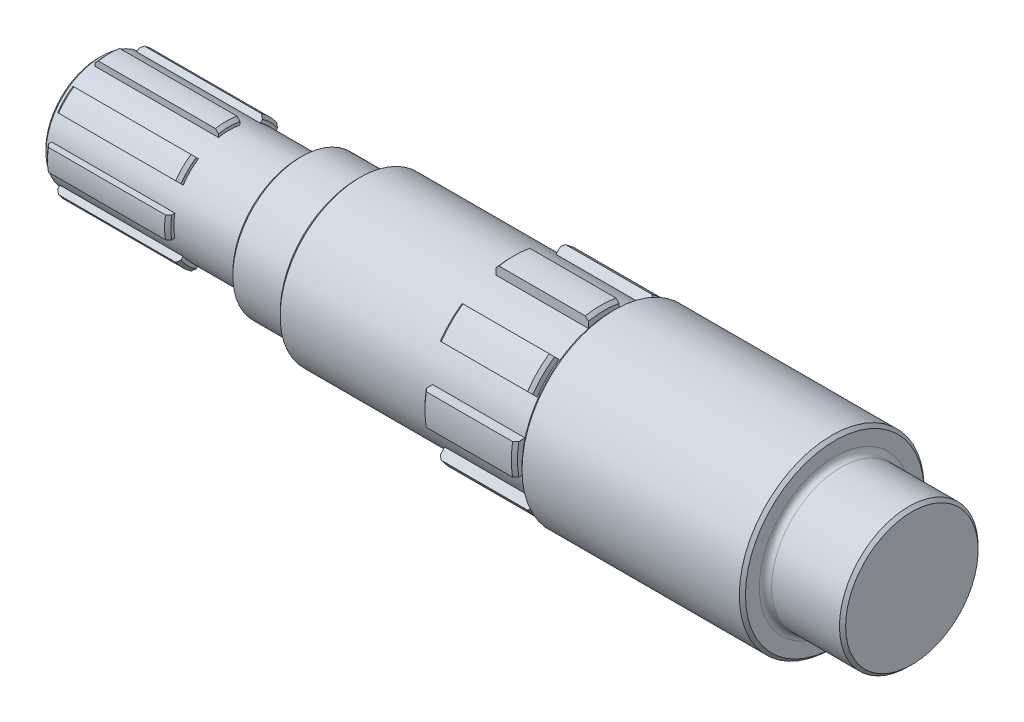
from build123d import *
from build123d.topology import SkipClean

# Parameters (mm, degrees)
CHAMFER1_SIZE      = 1
CUT_EXTRUDE1_REACH = 266.919
CUT_EXTRUDE2_REACH = 142.556
FILLET1_R          = 2


with BuildPart() as part:
    # Sketch1 → Revolve1 (revolve)
    with BuildSketch(Plane.XY, mode=Mode.PRIVATE) as revolve1_sk:
        Polygon((-90.956521739, 18), (-90.956521739, 22.347826087), (-71.956521739, 22.347826087), (-71.956521739, 26), (-21.956521739, 26), (-21.956521739, 29), (8.043478261, 29), (8.043478261, 26), (10.543478261, 26), (10.543478261, 30), (83.043478261, 30), (83.043478261, 22.5), (108.043478261, 22.5), (108.043478261, 0), (-155.956521739, 0), (-155.956521739, 18), (-153.456521739, 18), (-153.456521739, 20), (-113.456521739, 20), (-113.456521739, 18), align=None)
    revolve(revolve1_sk.sketch.rotate(Axis((-155.956521739, 0, 0), (1, 0, 0)), 90), axis=Axis((-155.956521739, 0, 0), (1, 0, 0)))

    # Chamfer1
    chamfer1_edges = [part.edges().sort_by_distance(p)[0] for p in [
        (108.043478261, 0, -22.5),
        (83.043478261, 0, -30),
        (10.543478261, 0, -30),
        (8.043478261, 0, -29),
        (-21.956521739, 0, -29),
        (-71.956521739, 0, -26),
        (-90.956521739, 0, -22.347826087),
        (-113.456521739, 0, -20),
        (-153.456521739, 0, -20),
        (-155.956521739, 0, -18),
    ]]
    chamfer(chamfer1_edges, length=CHAMFER1_SIZE)

    # Cut-Extrude1: up to this face of the body (flat: up to its plane)
    cut_extrude1_end = Plane(part.part.faces().sort_by_distance((-113.456521739, 0, -18.462598846))[0])
    # Sketch2 → Cut-Extrude1 (cut, up to the picked face)
    with BuildSketch(Plane.ZY.offset(153.456521739), mode=Mode.PRIVATE) as cut_extrude1_sk1:
        with BuildLine():
            Line((-3.5, 19.691368668), (-3.5, 17.656443583))
            ThreePointArc((-3.5, 17.656443583), (-6.888301783, 16.629831585), (-10.010117255, 14.959864723))
            Line((-10.010117255, 14.959864723), (-11.449026581, 16.39877405))
            ThreePointArc((-11.449026581, 16.39877405), (-7.653668647, 18.47759065), (-3.5, 19.691368668))
        make_face()
    cut_extrude1_tool1 = split(extrude(cut_extrude1_sk1.sketch, amount=-CUT_EXTRUDE1_REACH, mode=Mode.PRIVATE), bisect_by=cut_extrude1_end, keep=Keep.BOTH, mode=Mode.PRIVATE)
    # Sketch2 → Cut-Extrude1 (cut, up to the picked face)
    with BuildSketch(Plane.ZY.offset(153.456521739), mode=Mode.PRIVATE) as cut_extrude1_sk2:
        with BuildLine():
            Line((3.5, 19.691368668), (3.5, 17.656443583))
            ThreePointArc((3.5, 17.656443583), (6.888301783, 16.629831585), (10.010117255, 14.959864723))
            Line((10.010117255, 14.959864723), (11.449026581, 16.39877405))
            ThreePointArc((11.449026581, 16.39877405), (7.653668647, 18.47759065), (3.5, 19.691368668))
        make_face()
    cut_extrude1_tool2 = split(extrude(cut_extrude1_sk2.sketch, amount=-CUT_EXTRUDE1_REACH, mode=Mode.PRIVATE), bisect_by=cut_extrude1_end, keep=Keep.BOTH, mode=Mode.PRIVATE)
    # Sketch2 → Cut-Extrude1 (cut, up to the picked face)
    with BuildSketch(Plane.ZY.offset(153.456521739), mode=Mode.PRIVATE) as cut_extrude1_sk3:
        with BuildLine():
            Line((16.39877405, 11.449026581), (14.959864723, 10.010117255))
            ThreePointArc((14.959864723, 10.010117255), (16.629831585, 6.888301783), (17.656443583, 3.5))
            Line((17.656443583, 3.5), (19.691368668, 3.5))
            ThreePointArc((19.691368668, 3.5), (18.47759065, 7.653668647), (16.39877405, 11.449026581))
        make_face()
    cut_extrude1_tool3 = split(extrude(cut_extrude1_sk3.sketch, amount=-CUT_EXTRUDE1_REACH, mode=Mode.PRIVATE), bisect_by=cut_extrude1_end, keep=Keep.BOTH, mode=Mode.PRIVATE)
    # Sketch2 → Cut-Extrude1 (cut, up to the picked face)
    with BuildSketch(Plane.ZY.offset(153.456521739), mode=Mode.PRIVATE) as cut_extrude1_sk4:
        with BuildLine():
            Line((19.691368668, -3.5), (17.656443583, -3.5))
            ThreePointArc((17.656443583, -3.5), (16.629831585, -6.888301783), (14.959864723, -10.010117255))
            Line((14.959864723, -10.010117255), (16.39877405, -11.449026581))
            ThreePointArc((16.39877405, -11.449026581), (18.47759065, -7.653668647), (19.691368668, -3.5))
        make_face()
    cut_extrude1_tool4 = split(extrude(cut_extrude1_sk4.sketch, amount=-CUT_EXTRUDE1_REACH, mode=Mode.PRIVATE), bisect_by=cut_extrude1_end, keep=Keep.BOTH, mode=Mode.PRIVATE)
    # Sketch2 → Cut-Extrude1 (cut, up to the picked face)
    with BuildSketch(Plane.ZY.offset(153.456521739), mode=Mode.PRIVATE) as cut_extrude1_sk5:
        with BuildLine():
            Line((11.449026581, -16.39877405), (10.010117255, -14.959864723))
            ThreePointArc((10.010117255, -14.959864723), (6.888301783, -16.629831585), (3.5, -17.656443583))
            Line((3.5, -17.656443583), (3.5, -19.691368668))
            ThreePointArc((3.5, -19.691368668), (7.653668647, -18.47759065), (11.449026581, -16.39877405))
        make_face()
    cut_extrude1_tool5 = split(extrude(cut_extrude1_sk5.sketch, amount=-CUT_EXTRUDE1_REACH, mode=Mode.PRIVATE), bisect_by=cut_extrude1_end, keep=Keep.BOTH, mode=Mode.PRIVATE)
    # Sketch2 → Cut-Extrude1 (cut, up to the picked face)
    with BuildSketch(Plane.ZY.offset(153.456521739), mode=Mode.PRIVATE) as cut_extrude1_sk6:
        with BuildLine():
            Line((-3.5, -19.691368668), (-3.5, -17.656443583))
            ThreePointArc((-3.5, -17.656443583), (-6.888301783, -16.629831585), (-10.010117255, -14.959864723))
            Line((-10.010117255, -14.959864723), (-11.449026581, -16.39877405))
            ThreePointArc((-11.449026581, -16.39877405), (-7.653668647, -18.47759065), (-3.5, -19.691368668))
        make_face()
    cut_extrude1_tool6 = split(extrude(cut_extrude1_sk6.sketch, amount=-CUT_EXTRUDE1_REACH, mode=Mode.PRIVATE), bisect_by=cut_extrude1_end, keep=Keep.BOTH, mode=Mode.PRIVATE)
    # Sketch2 → Cut-Extrude1 (cut, up to the picked face)
    with BuildSketch(Plane.ZY.offset(153.456521739), mode=Mode.PRIVATE) as cut_extrude1_sk7:
        with BuildLine():
            Line((-16.39877405, -11.449026581), (-14.959864723, -10.010117255))
            ThreePointArc((-14.959864723, -10.010117255), (-16.629831585, -6.888301783), (-17.656443583, -3.5))
            Line((-17.656443583, -3.5), (-19.691368668, -3.5))
            ThreePointArc((-19.691368668, -3.5), (-18.47759065, -7.653668647), (-16.39877405, -11.449026581))
        make_face()
    cut_extrude1_tool7 = split(extrude(cut_extrude1_sk7.sketch, amount=-CUT_EXTRUDE1_REACH, mode=Mode.PRIVATE), bisect_by=cut_extrude1_end, keep=Keep.BOTH, mode=Mode.PRIVATE)
    # Sketch2 → Cut-Extrude1 (cut, up to the picked face)
    with BuildSketch(Plane.ZY.offset(153.456521739), mode=Mode.PRIVATE) as cut_extrude1_sk8:
        with BuildLine():
            Line((-19.691368668, 3.5), (-17.656443583, 3.5))
            ThreePointArc((-17.656443583, 3.5), (-16.629831585, 6.888301783), (-14.959864723, 10.010117255))
            Line((-14.959864723, 10.010117255), (-16.39877405, 11.449026581))
            ThreePointArc((-16.39877405, 11.449026581), (-18.47759065, 7.653668647), (-19.691368668, 3.5))
        make_face()
    cut_extrude1_tool8 = split(extrude(cut_extrude1_sk8.sketch, amount=-CUT_EXTRUDE1_REACH, mode=Mode.PRIVATE), bisect_by=cut_extrude1_end, keep=Keep.BOTH, mode=Mode.PRIVATE)
    add(cut_extrude1_tool1.solids().sort_by(Axis((-153.456522, 17.458245, -7.231442), (1, 0, 0)))[0], mode=Mode.SUBTRACT)
    add(cut_extrude1_tool2.solids().sort_by(Axis((-153.456522, 17.458245, 7.231442), (1, 0, 0)))[0], mode=Mode.SUBTRACT)
    add(cut_extrude1_tool3.solids().sort_by(Axis((-153.456522, 7.231442, 17.458245), (1, 0, 0)))[0], mode=Mode.SUBTRACT)
    add(cut_extrude1_tool4.solids().sort_by(Axis((-153.456522, -7.231442, 17.458245), (1, 0, 0)))[0], mode=Mode.SUBTRACT)
    add(cut_extrude1_tool5.solids().sort_by(Axis((-153.456522, -17.458245, 7.231442), (1, 0, 0)))[0], mode=Mode.SUBTRACT)
    add(cut_extrude1_tool6.solids().sort_by(Axis((-153.456522, -17.458245, -7.231442), (1, 0, 0)))[0], mode=Mode.SUBTRACT)
    add(cut_extrude1_tool7.solids().sort_by(Axis((-153.456522, -7.231442, -17.458245), (1, 0, 0)))[0], mode=Mode.SUBTRACT)
    add(cut_extrude1_tool8.solids().sort_by(Axis((-153.456522, 7.231442, -17.458245), (1, 0, 0)))[0], mode=Mode.SUBTRACT)

    # Cut-Extrude2: up to this face of the body (flat: up to its plane)
    cut_extrude2_end = Plane(part.part.faces().sort_by_distance((8.043478261, 0, -27.208040405))[0])
    # Sketch3 → Cut-Extrude2 (cut, up to the picked face)
    with BuildSketch(Plane.ZY.offset(21.956521739), mode=Mode.PRIVATE) as cut_extrude2_sk1:
        with BuildLine():
            Line((-5, 28.565713714), (-5, 25.514701644))
            ThreePointArc((-5, 25.514701644), (-9.949769241, 24.020867845), (-14.506084647, 21.577152459))
            Line((-14.506084647, 21.577152459), (-16.663475971, 23.734543783))
            ThreePointArc((-16.663475971, 23.734543783), (-11.097819539, 26.792506443), (-5, 28.565713714))
        make_face()
    cut_extrude2_tool1 = split(extrude(cut_extrude2_sk1.sketch, amount=-CUT_EXTRUDE2_REACH, mode=Mode.PRIVATE), bisect_by=cut_extrude2_end, keep=Keep.BOTH, mode=Mode.PRIVATE)
    # Sketch3 → Cut-Extrude2 (cut, up to the picked face)
    with BuildSketch(Plane.ZY.offset(21.956521739), mode=Mode.PRIVATE) as cut_extrude2_sk2:
        with BuildLine():
            Line((5, 28.565713714), (5, 25.514701644))
            ThreePointArc((5, 25.514701644), (9.949769241, 24.020867845), (14.506084647, 21.577152459))
            Line((14.506084647, 21.577152459), (16.663475971, 23.734543783))
            ThreePointArc((16.663475971, 23.734543783), (11.097819539, 26.792506443), (5, 28.565713714))
        make_face()
    cut_extrude2_tool2 = split(extrude(cut_extrude2_sk2.sketch, amount=-CUT_EXTRUDE2_REACH, mode=Mode.PRIVATE), bisect_by=cut_extrude2_end, keep=Keep.BOTH, mode=Mode.PRIVATE)
    # Sketch3 → Cut-Extrude2 (cut, up to the picked face)
    with BuildSketch(Plane.ZY.offset(21.956521739), mode=Mode.PRIVATE) as cut_extrude2_sk3:
        with BuildLine():
            Line((23.734543783, 16.663475971), (21.577152459, 14.506084647))
            ThreePointArc((21.577152459, 14.506084647), (24.020867845, 9.949769241), (25.514701644, 5))
            Line((25.514701644, 5), (28.565713714, 5))
            ThreePointArc((28.565713714, 5), (26.792506443, 11.097819539), (23.734543783, 16.663475971))
        make_face()
    cut_extrude2_tool3 = split(extrude(cut_extrude2_sk3.sketch, amount=-CUT_EXTRUDE2_REACH, mode=Mode.PRIVATE), bisect_by=cut_extrude2_end, keep=Keep.BOTH, mode=Mode.PRIVATE)
    # Sketch3 → Cut-Extrude2 (cut, up to the picked face)
    with BuildSketch(Plane.ZY.offset(21.956521739), mode=Mode.PRIVATE) as cut_extrude2_sk4:
        with BuildLine():
            Line((28.565713714, -5), (25.514701644, -5))
            ThreePointArc((25.514701644, -5), (24.020867845, -9.949769241), (21.577152459, -14.506084647))
            Line((21.577152459, -14.506084647), (23.734543783, -16.663475971))
            ThreePointArc((23.734543783, -16.663475971), (26.792506443, -11.097819539), (28.565713714, -5))
        make_face()
    cut_extrude2_tool4 = split(extrude(cut_extrude2_sk4.sketch, amount=-CUT_EXTRUDE2_REACH, mode=Mode.PRIVATE), bisect_by=cut_extrude2_end, keep=Keep.BOTH, mode=Mode.PRIVATE)
    # Sketch3 → Cut-Extrude2 (cut, up to the picked face)
    with BuildSketch(Plane.ZY.offset(21.956521739), mode=Mode.PRIVATE) as cut_extrude2_sk5:
        with BuildLine():
            Line((16.663475971, -23.734543783), (14.506084647, -21.577152459))
            ThreePointArc((14.506084647, -21.577152459), (9.949769241, -24.020867845), (5, -25.514701644))
            Line((5, -25.514701644), (5, -28.565713714))
            ThreePointArc((5, -28.565713714), (11.097819539, -26.792506443), (16.663475971, -23.734543783))
        make_face()
    cut_extrude2_tool5 = split(extrude(cut_extrude2_sk5.sketch, amount=-CUT_EXTRUDE2_REACH, mode=Mode.PRIVATE), bisect_by=cut_extrude2_end, keep=Keep.BOTH, mode=Mode.PRIVATE)
    # Sketch3 → Cut-Extrude2 (cut, up to the picked face)
    with BuildSketch(Plane.ZY.offset(21.956521739), mode=Mode.PRIVATE) as cut_extrude2_sk6:
        with BuildLine():
            Line((-5, -28.565713714), (-5, -25.514701644))
            ThreePointArc((-5, -25.514701644), (-9.949769241, -24.020867845), (-14.506084647, -21.577152459))
            Line((-14.506084647, -21.577152459), (-16.663475971, -23.734543783))
            ThreePointArc((-16.663475971, -23.734543783), (-11.097819539, -26.792506443), (-5, -28.565713714))
        make_face()
    cut_extrude2_tool6 = split(extrude(cut_extrude2_sk6.sketch, amount=-CUT_EXTRUDE2_REACH, mode=Mode.PRIVATE), bisect_by=cut_extrude2_end, keep=Keep.BOTH, mode=Mode.PRIVATE)
    # Sketch3 → Cut-Extrude2 (cut, up to the picked face)
    with BuildSketch(Plane.ZY.offset(21.956521739), mode=Mode.PRIVATE) as cut_extrude2_sk7:
        with BuildLine():
            Line((-23.734543783, -16.663475971), (-21.577152459, -14.506084647))
            ThreePointArc((-21.577152459, -14.506084647), (-24.020867845, -9.949769241), (-25.514701644, -5))
            Line((-25.514701644, -5), (-28.565713714, -5))
            ThreePointArc((-28.565713714, -5), (-26.792506443, -11.097819539), (-23.734543783, -16.663475971))
        make_face()
    cut_extrude2_tool7 = split(extrude(cut_extrude2_sk7.sketch, amount=-CUT_EXTRUDE2_REACH, mode=Mode.PRIVATE), bisect_by=cut_extrude2_end, keep=Keep.BOTH, mode=Mode.PRIVATE)
    # Sketch3 → Cut-Extrude2 (cut, up to the picked face)
    with BuildSketch(Plane.ZY.offset(21.956521739), mode=Mode.PRIVATE) as cut_extrude2_sk8:
        with BuildLine():
            Line((-28.565713714, 5), (-25.514701644, 5))
            ThreePointArc((-25.514701644, 5), (-24.020867845, 9.949769241), (-21.577152459, 14.506084647))
            Line((-21.577152459, 14.506084647), (-23.734543783, 16.663475971))
            ThreePointArc((-23.734543783, 16.663475971), (-26.792506443, 11.097819539), (-28.565713714, 5))
        make_face()
    cut_extrude2_tool8 = split(extrude(cut_extrude2_sk8.sketch, amount=-CUT_EXTRUDE2_REACH, mode=Mode.PRIVATE), bisect_by=cut_extrude2_end, keep=Keep.BOTH, mode=Mode.PRIVATE)
    add(cut_extrude2_tool1.solids().sort_by(Axis((-21.956522, 25.266905, -10.465895), (1, 0, 0)))[0], mode=Mode.SUBTRACT)
    add(cut_extrude2_tool2.solids().sort_by(Axis((-21.956522, 25.266905, 10.465895), (1, 0, 0)))[0], mode=Mode.SUBTRACT)
    add(cut_extrude2_tool3.solids().sort_by(Axis((-21.956522, 10.465895, 25.266905), (1, 0, 0)))[0], mode=Mode.SUBTRACT)
    add(cut_extrude2_tool4.solids().sort_by(Axis((-21.956522, -10.465895, 25.266905), (1, 0, 0)))[0], mode=Mode.SUBTRACT)
    add(cut_extrude2_tool5.solids().sort_by(Axis((-21.956522, -25.266905, 10.465895), (1, 0, 0)))[0], mode=Mode.SUBTRACT)
    add(cut_extrude2_tool6.solids().sort_by(Axis((-21.956522, -25.266905, -10.465895), (1, 0, 0)))[0], mode=Mode.SUBTRACT)
    add(cut_extrude2_tool7.solids().sort_by(Axis((-21.956522, -10.465895, -25.266905), (1, 0, 0)))[0], mode=Mode.SUBTRACT)
    add(cut_extrude2_tool8.solids().sort_by(Axis((-21.956522, 10.465895, -25.266905), (1, 0, 0)))[0], mode=Mode.SUBTRACT)

    # Fillet1
    fillet1_edges = [part.edges().sort_by_distance(p)[0] for p in [
        (83.043478261, 0, -22.5),
        (10.543478261, 0, -26),
        (-71.956521739, 0, -22.347826087),
        (-90.956521739, 0, -18),
    ]]
    fillet(fillet1_edges, radius=FILLET1_R)


solid = part.part
